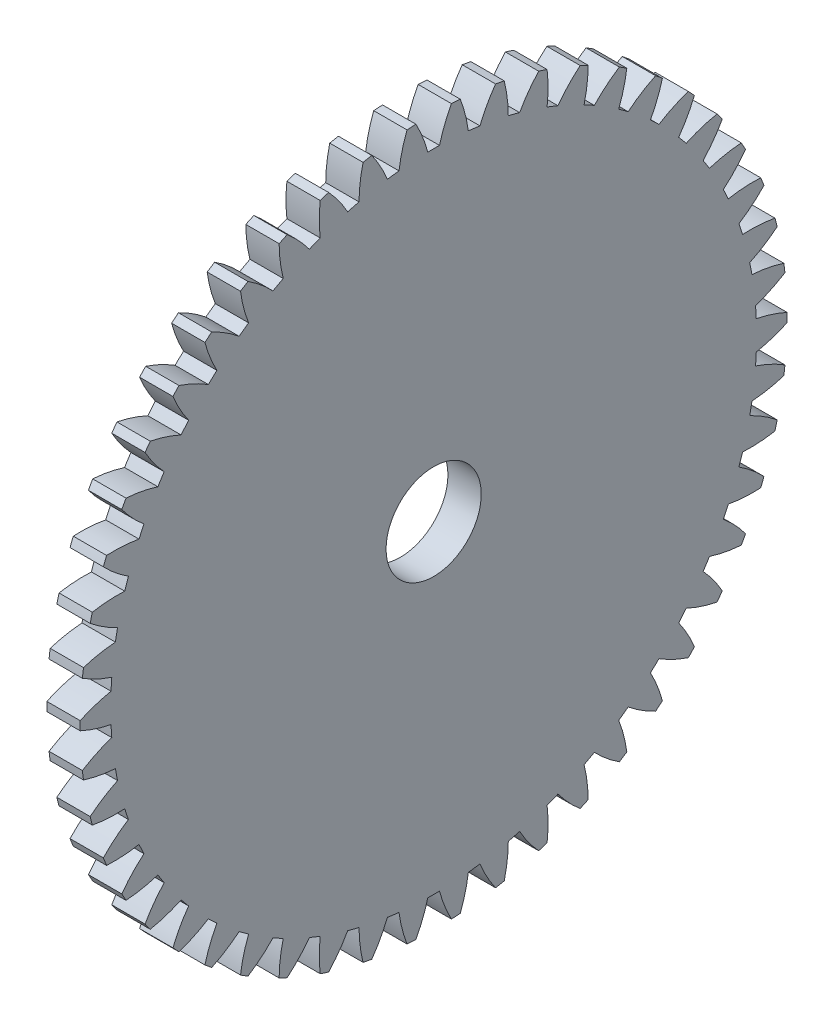
from build123d import *

# Parameters (mm, degrees)
BASPROSKE_W     = 4.9
BASPROSKE_H     = 52
TOOTHCUT_DEPTH  = 74.702170931
TEETHCUTS_COUNT = 50
TEETHCUTS_ANGLE = 352.8
BORSKE_R        = 7
BORE_DEPTH      = 50.0000508


with BuildPart() as part:
    # BasProSke → Base-Revolve (revolve)
    with BuildSketch(Plane(origin=(0, 0, 0), x_dir=(1, 0, 0), z_dir=(0, 1, 0)), mode=Mode.PRIVATE) as base_revolve_sk:
        with Locations((2.45, 26)):
            Rectangle(BASPROSKE_W, BASPROSKE_H)
    revolve(base_revolve_sk.sketch.rotate(Axis((-10, 0, 0), (1, 0, 0)), 180), axis=Axis((-10, 0, 0), (1, 0, 0)))

    # TooCutSke → ToothCut (cut, through all)
    with BuildSketch(Plane(origin=(0, 0, 0), x_dir=(0, 0, -1), z_dir=(1, 0, 0))):
        with BuildLine():
            ThreePointArc((0.86062222, 47.491202663), (0, 47.499), (-0.86062222, 47.491202663))
            ThreePointArc((-0.86062222, 47.491202663), (-1.610166517, 49.778366785), (-2.629027787, 51.958930494))
            ThreePointArc((-2.629027787, 51.958930494), (0, 52.0254), (2.629027787, 51.958930494))
            ThreePointArc((2.629027787, 51.958930494), (1.610166517, 49.778366785), (0.86062222, 47.491202663))
        make_face()
    toothcut = extrude(amount=TOOTHCUT_DEPTH, mode=Mode.SUBTRACT)

    # TeethCuts: ToothCut ×50 about axis
    teethcuts_axis = Axis((-10, 0, 0), (1, 0, 0))
    for i in range(1, TEETHCUTS_COUNT):
        add(toothcut.rotate(teethcuts_axis, i * TEETHCUTS_ANGLE / (TEETHCUTS_COUNT - 1)), mode=Mode.SUBTRACT)

    # BorSke → Bore (cut, symmetric)
    with BuildSketch(Plane(origin=(0, 0, 0), x_dir=(0, 0, -1), z_dir=(1, 0, 0))):
        with Locations(Location((0, 0, 0), (0, 0, 180))):
            Circle(BORSKE_R)
    extrude(amount=BORE_DEPTH, both=True, mode=Mode.SUBTRACT)


solid = part.part
